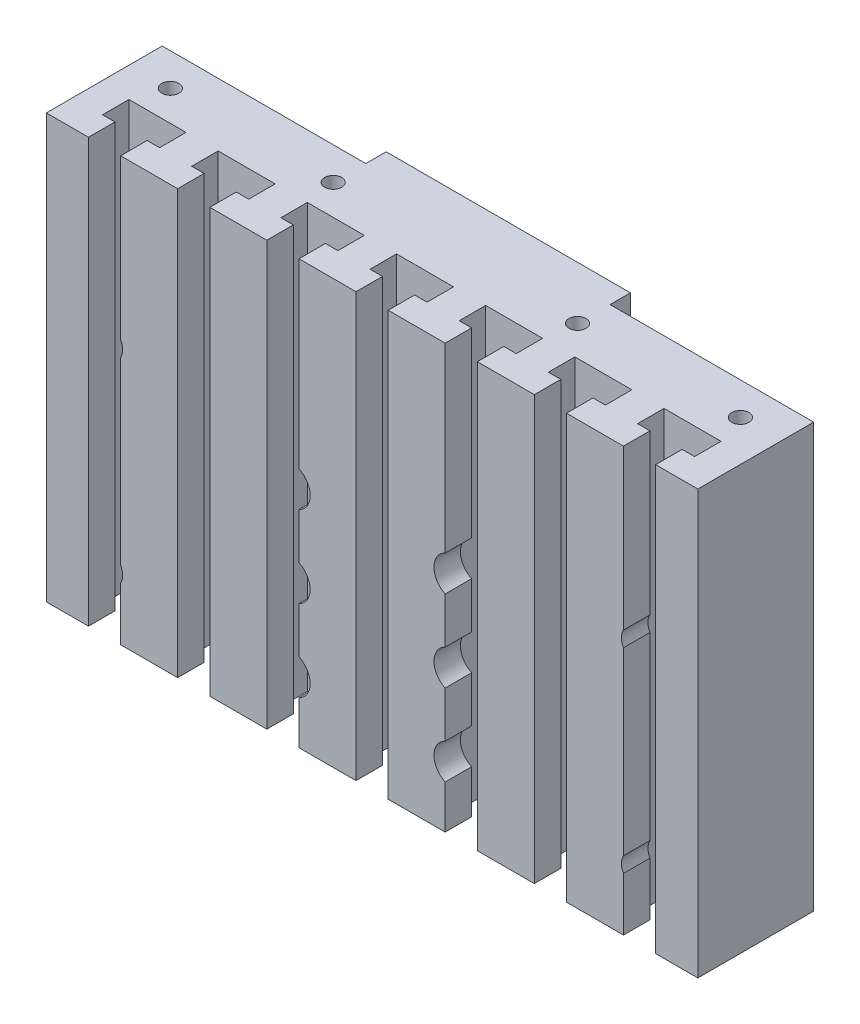
from build123d import *

# Parameters (mm, degrees)
SKETCH1_W           = 160
SKETCH1_H           = 104
SKETCH1_R           = 2.5
BOSS_EXTRUDE1_DEPTH = 28.45
CUT_EXTRUDE1_DEPTH  = 135.258714801
SKETCH5_W           = 60
SKETCH5_H           = 104
BOSS_EXTRUDE2_DEPTH = 5
SKETCH3_R           = 4.8
CUT_EXTRUDE2_DEPTH  = 7
CUT_EXTRUDE3_START  = 6.5
SKETCH4_R           = 4.8
CUT_EXTRUDE3_DEPTH  = 13.35
SKETCH6_R           = 2.5
CUT_EXTRUDE4_DEPTH  = 100.566071028
SKETCH7_R           = 2.1
CUT_EXTRUDE5_DEPTH  = 12
CUT_EXTRUDE6_START  = -12
SKETCH8_R           = 2.1
CUT_EXTRUDE6_DEPTH  = 12
SKETCH9_R           = 3.75
CUT_EXTRUDE7_DEPTH  = 26


with BuildPart() as part:
    # Sketch1 → Boss-Extrude1 (new body)
    with BuildSketch(Plane.XY):
        Rectangle(SKETCH1_W, SKETCH1_H)
        with Locations((20, -37)):
            Circle(SKETCH1_R, mode=Mode.SUBTRACT)
        with Locations(Location((-20, -37, 0), (0, 0, 180))):
            Circle(SKETCH1_R, mode=Mode.SUBTRACT)
        with Locations((20, -17)):
            Circle(SKETCH1_R, mode=Mode.SUBTRACT)
        with Locations((20, 3)):
            Circle(SKETCH1_R, mode=Mode.SUBTRACT)
        with Locations(Location((-20, 3, 0), (0, 0, 180))):
            Circle(SKETCH1_R, mode=Mode.SUBTRACT)
        with Locations(Location((-20, -17, 0), (0, 0, 180))):
            Circle(SKETCH1_R, mode=Mode.SUBTRACT)
    extrude(amount=BOSS_EXTRUDE1_DEPTH)

    # Sketch2 → Cut-Extrude1 (cut, through all)
    with BuildSketch(Plane(origin=(0, 52, 0), x_dir=(1, 0, 0), z_dir=(0, 1, 0))):
        Polygon((-3.95, -28.45), (3.95, -28.45), (3.95, -21.95), (7, -21.95), (7, -15.45), (-7, -15.45), (-7, -21.95), (-3.95, -21.95), align=None)
        Polygon((25.85, -28.45), (25.85, -21.95), (28.9, -21.95), (28.9, -15.45), (14.9, -15.45), (14.9, -21.95), (17.95, -21.95), (17.95, -28.45), align=None)
        Polygon((47.75, -28.45), (47.75, -21.95), (50.8, -21.95), (50.8, -15.45), (36.8, -15.45), (36.8, -21.95), (39.85, -21.95), (39.85, -28.45), align=None)
        Polygon((69.65, -28.45), (69.65, -21.95), (72.7, -21.95), (72.7, -15.45), (58.7, -15.45), (58.7, -21.95), (61.75, -21.95), (61.75, -28.45), align=None)
        Polygon((-28.9, -15.45), (-28.9, -21.95), (-25.85, -21.95), (-25.85, -28.45), (-17.95, -28.45), (-17.95, -21.95), (-14.9, -21.95), (-14.9, -15.45), align=None)
        Polygon((-50.8, -15.45), (-50.8, -21.95), (-47.75, -21.95), (-47.75, -28.45), (-39.85, -28.45), (-39.85, -21.95), (-36.8, -21.95), (-36.8, -15.45), align=None)
        Polygon((-72.7, -15.45), (-72.7, -21.95), (-69.65, -21.95), (-69.65, -28.45), (-61.75, -28.45), (-61.75, -21.95), (-58.7, -21.95), (-58.7, -15.45), align=None)
    extrude(amount=-CUT_EXTRUDE1_DEPTH, mode=Mode.SUBTRACT)

    # Sketch5 → Boss-Extrude2 (add)
    with BuildSketch(Plane(origin=(0, 0, 0), x_dir=(-1, 0, 0), z_dir=(0, 0, -1))):
        Rectangle(SKETCH5_W, SKETCH5_H)
    extrude(amount=BOSS_EXTRUDE2_DEPTH)

    # Sketch3 → Cut-Extrude2 (cut)
    with BuildSketch(Plane.XY.offset(28.45)):
        with Locations((-20, 3)):
            Circle(SKETCH3_R)
        with Locations((20, 3)):
            Circle(SKETCH3_R)
        with Locations((-20, -17)):
            Circle(SKETCH3_R)
        with Locations((20, -17)):
            Circle(SKETCH3_R)
        with Locations((-20, -37)):
            Circle(SKETCH3_R)
        with Locations((20, -37)):
            Circle(SKETCH3_R)
    extrude(amount=-CUT_EXTRUDE2_DEPTH, mode=Mode.SUBTRACT)

    # Sketch4 → Cut-Extrude3 (cut)
    with BuildSketch(Plane.XY.offset(15.45).offset(CUT_EXTRUDE3_START)):
        with Locations((-20, 3)):
            Circle(SKETCH4_R)
        with Locations((20, 3)):
            Circle(SKETCH4_R)
        with Locations((-20, -17)):
            Circle(SKETCH4_R)
        with Locations((20, -17)):
            Circle(SKETCH4_R)
        with Locations((-20, -37)):
            Circle(SKETCH4_R)
        with Locations((20, -37)):
            Circle(SKETCH4_R)
    extrude(amount=-CUT_EXTRUDE3_DEPTH, mode=Mode.SUBTRACT)

    # Sketch6 → Cut-Extrude4 (cut, through all)
    with BuildSketch(Plane.XY):
        with Locations((-20, 3)):
            Circle(SKETCH6_R)
        with Locations((20, 3)):
            Circle(SKETCH6_R)
        with Locations((-20, -17)):
            Circle(SKETCH6_R)
        with Locations((20, -17)):
            Circle(SKETCH6_R)
        with Locations((20, -37)):
            Circle(SKETCH6_R)
        with Locations((-20, -37)):
            Circle(SKETCH6_R)
    extrude(amount=-CUT_EXTRUDE4_DEPTH, mode=Mode.SUBTRACT)

    # Sketch7 → Cut-Extrude5 (cut)
    with BuildSketch(Plane(origin=(0, 52, 0), x_dir=(1, 0, 0), z_dir=(0, 1, 0))):
        with Locations(Location((-70, -8, 0), (0, 0, 180))):
            Circle(SKETCH7_R)
        with Locations(Location((-30, -8, 0), (0, 0, 180))):
            Circle(SKETCH7_R)
        with Locations((70, -8)):
            Circle(SKETCH7_R)
        with Locations((30, -8)):
            Circle(SKETCH7_R)
    extrude(amount=-CUT_EXTRUDE5_DEPTH, mode=Mode.SUBTRACT)

    # Sketch8 → Cut-Extrude6 (cut)
    with BuildSketch(Plane.XZ.offset(52).offset(CUT_EXTRUDE6_START)):
        with Locations((70, 8)):
            Circle(SKETCH8_R)
        with Locations((30, 8)):
            Circle(SKETCH8_R)
        with Locations(Location((-30, 8, 0), (0, 0, 180))):
            Circle(SKETCH8_R)
        with Locations(Location((-70, 8, 0), (0, 0, 180))):
            Circle(SKETCH8_R)
    extrude(amount=CUT_EXTRUDE6_DEPTH, mode=Mode.SUBTRACT)

    # Sketch9 → Cut-Extrude7 (cut)
    with BuildSketch(Plane.XY.offset(28.45)):
        with Locations((-65, 11)):
            Circle(SKETCH9_R)
        with Locations((-65, -37)):
            Circle(SKETCH9_R)
        with Locations((65, -37)):
            Circle(SKETCH9_R)
        with Locations((65, 11)):
            Circle(SKETCH9_R)
    extrude(amount=-CUT_EXTRUDE7_DEPTH, mode=Mode.SUBTRACT)


solid = part.part
